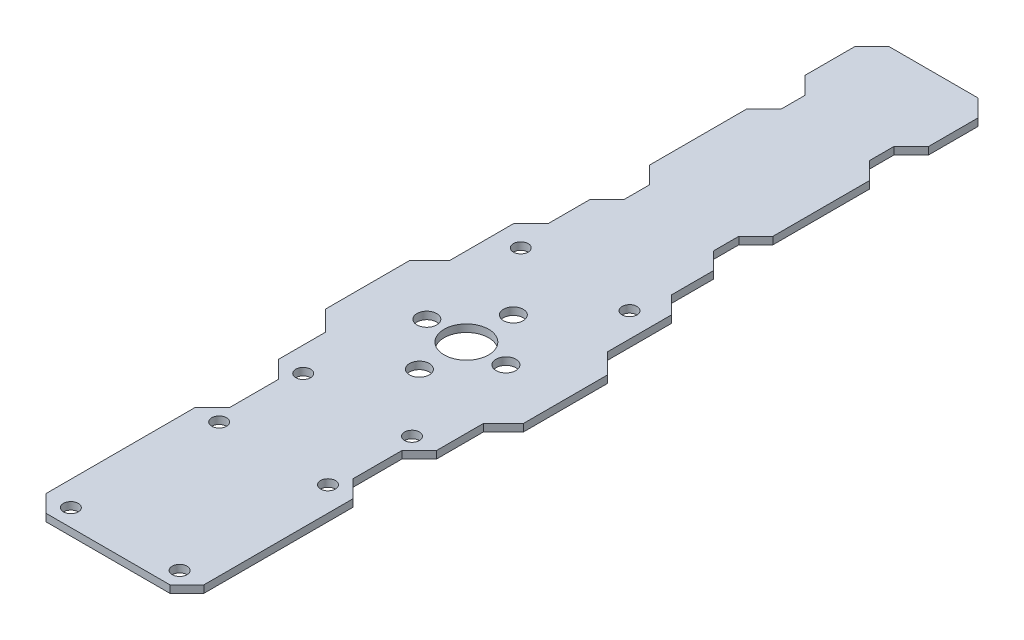
from build123d import *

# Parameters (mm, degrees)
SKETCH_1_R      = 4.5
SKETCH_1_R_2    = 2
SKETCH_1_R_3    = 1.5
EXTRUDE_1_DEPTH = 1.5


with BuildPart() as part:
    # 草图1 → 凸台-拉伸1 (new body)
    with BuildSketch(Plane(origin=(0, 0, 0), x_dir=(1, 0, 0), z_dir=(0, 1, 0))):
        Polygon((20.023596815, 17.047193631), (20.023596815, 34), (15.976403185, 38.047193631), (15.976403185, 51), (12.476403185, 54.5), (12.476403185, 57), (12.476403185, 63.031398934), (9.023596815, 66.484205303), (9.023596815, 71.578592565), (12.476403185, 75.031398934), (12.476403185, 94.595844768), (8.976403185, 98.095844768), (8.976403185, 103.001457506), (12.476403185, 106.501457506), (12.476403185, 116.5), (8.976403185, 120), (-8.976403185, 120), (-12.476403185, 116.5), (-12.476403185, 106.501457506), (-8.976403185, 103.001457506), (-8.976403185, 98.095844768), (-12.476403185, 94.595844768), (-12.476403185, 75.031398934), (-9.023596815, 71.578592565), (-9.023596815, 66.484205303), (-12.476403185, 63.031398934), (-12.476403185, 57), (-12.476403185, 54.5), (-15.976403185, 51), (-15.976403185, 38.047193631), (-20.023596815, 34), (-20.023596815, 17.047193631), (-15.976403185, 13), (-15.976403185, 3.452806369), (-12.476403185, -0.047193631), (-12.476403185, -9.952806369), (-15.976403185, -13.452806369), (-15.976403185, -43.547193631), (-12.523596815, -47), (12.523596815, -47), (15.976403185, -43.547193631), (15.976403185, -13.452806369), (12.476403185, -9.952806369), (12.476403185, -0.047193631), (15.976403185, 3.452806369), (15.976403185, 13), align=None)
        with Locations(Location((0, 25.5, 0), (0, 0, 270))):
            Circle(SKETCH_1_R, mode=Mode.SUBTRACT)
        with Locations(Location((8, 25.5, 0), (0, 0, 270))):
            Circle(SKETCH_1_R_2, mode=Mode.SUBTRACT)
        with Locations(Location((0, 16, 0), (0, 0, 270))):
            Circle(SKETCH_1_R_2, mode=Mode.SUBTRACT)
        with Locations(Location((-8, 25.5, 0), (0, 0, 270))):
            Circle(SKETCH_1_R_2, mode=Mode.SUBTRACT)
        with Locations(Location((0, 35, 0), (0, 0, 270))):
            Circle(SKETCH_1_R_2, mode=Mode.SUBTRACT)
        with Locations(Location((11, 3.5, 0), (0, 0, 270))):
            Circle(SKETCH_1_R_3, mode=Mode.SUBTRACT)
        with Locations(Location((11, 47.5, 0), (0, 0, 270))):
            Circle(SKETCH_1_R_3, mode=Mode.SUBTRACT)
        with Locations(Location((-11, 47.5, 0), (0, 0, 90))):
            Circle(SKETCH_1_R_3, mode=Mode.SUBTRACT)
        with Locations(Location((-11, 3.5, 0), (0, 0, 90))):
            Circle(SKETCH_1_R_3, mode=Mode.SUBTRACT)
        with Locations(Location((11, -13.5, 0), (0, 0, 270))):
            Circle(SKETCH_1_R_3, mode=Mode.SUBTRACT)
        with Locations(Location((11, -43.5, 0), (0, 0, 270))):
            Circle(SKETCH_1_R_3, mode=Mode.SUBTRACT)
        with Locations(Location((-11, -13.5, 0), (0, 0, 90))):
            Circle(SKETCH_1_R_3, mode=Mode.SUBTRACT)
        with Locations(Location((-11, -43.5, 0), (0, 0, 90))):
            Circle(SKETCH_1_R_3, mode=Mode.SUBTRACT)
    extrude(amount=EXTRUDE_1_DEPTH)


solid = part.part
